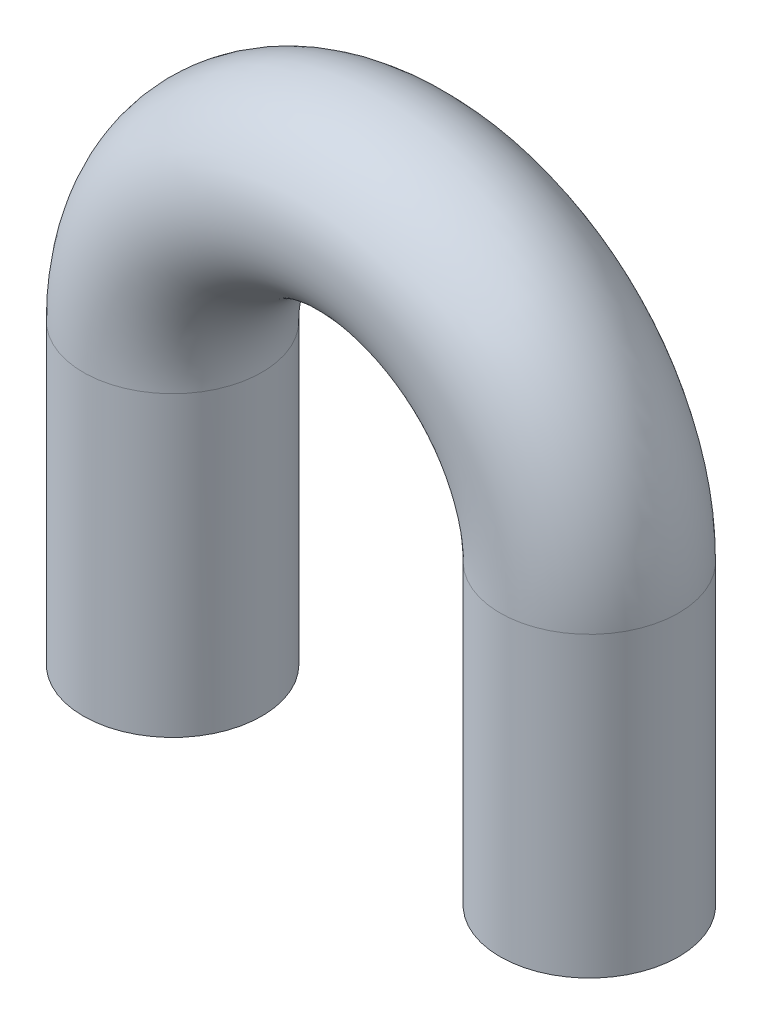
from build123d import *

# Parameters (mm, degrees)
SKETCH1_R             = 3.81
BOSS_EXTRUDE1_DEPTH   = 12.7
BOSS_EXTRUDE1_2_DEPTH = 12.7
SKETCH3_R             = 3.81
REVOLVE1_ANGLE        = 180


with BuildPart() as part:
    # Sketch1 → Boss-Extrude1 (new body)
    with BuildSketch(Plane(origin=(0, 0, 0), x_dir=(1, 0, 0), z_dir=(0, 1, 0))):
        with Locations(Location((-8.89, 0, 0), (0, 0, 270))):
            Circle(SKETCH1_R)
    extrude(amount=BOSS_EXTRUDE1_DEPTH)



with BuildPart() as body_2:
    # Sketch1 → Boss-Extrude1 2 (new body)
    with BuildSketch(Plane(origin=(0, 0, 0), x_dir=(1, 0, 0), z_dir=(0, 1, 0))):
        with Locations(Location((8.89, 0, 0), (0, 0, 270))):
            Circle(SKETCH1_R)
    extrude(amount=BOSS_EXTRUDE1_2_DEPTH)


with BuildPart() as part_1:
    add(part.part)

    add(body_2.part)  # Revolve1 merges body 2
    # Sketch3 → Revolve1 (revolve)
    with BuildSketch(Plane(origin=(0, 12.7, 0), x_dir=(1, 0, 0), z_dir=(0, 1, 0))):
        with Locations(Location((-8.89, 0, 0), (0, 0, 180))):
            Circle(SKETCH3_R)
    revolve(axis=Axis((0, 12.7, -9.3183346), (0, 0, -1)), revolution_arc=REVOLVE1_ANGLE)


solid = part_1.part
